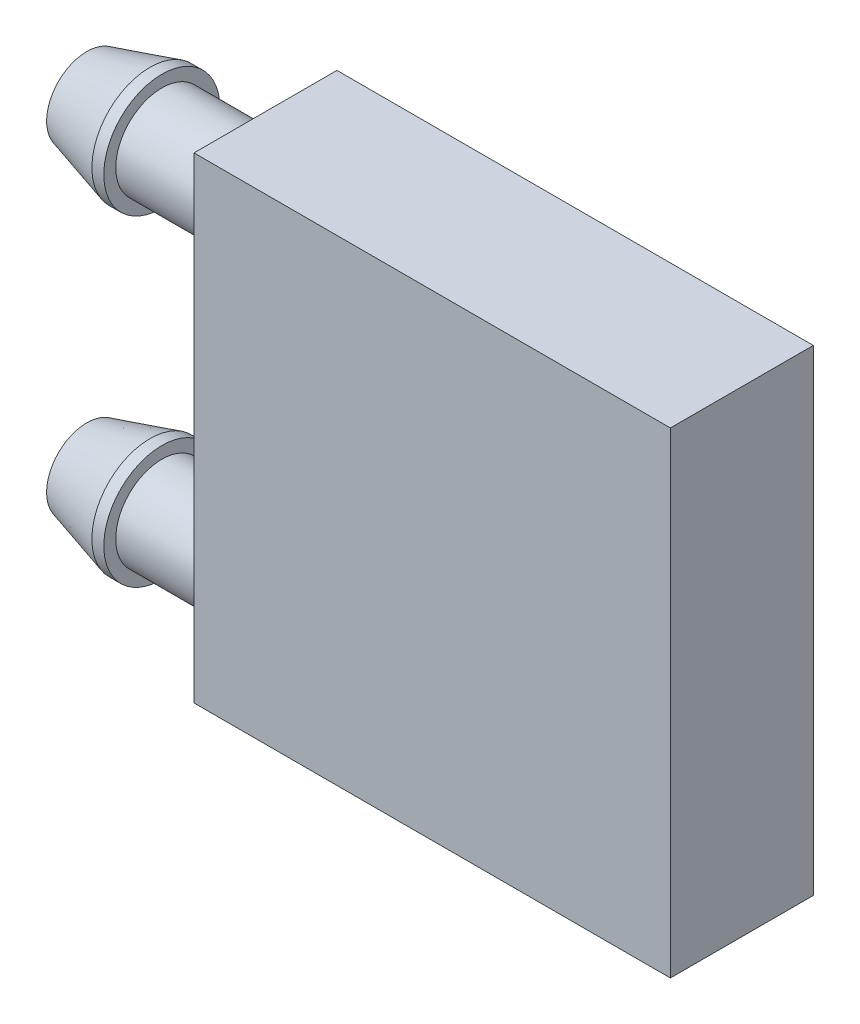
from build123d import *

# Parameters (mm, degrees)
BOSS_EXTRUDE_BASE_DEPTH      = 6
BOSS_EXTRUDE_BASE_DEPTH_BACK = 6
BASE_W                       = 40.00000001
BASE_H                       = 40


with BuildPart() as part:
    # Base → Boss-Extrude Base (new, two sides: drawn at the far end of the back side and taken through both)
    with BuildSketch(Plane.XY.offset(-BOSS_EXTRUDE_BASE_DEPTH_BACK)):
        with Locations((-10, 0)):
            Rectangle(BASE_W, BASE_H)
    extrude(amount=BOSS_EXTRUDE_BASE_DEPTH + BOSS_EXTRUDE_BASE_DEPTH_BACK)

    # Port Profile → Revolve Port (revolve)
    with BuildSketch(Plane.XY):
        Polygon((-30.000000005, 16.375000092), (-45.000000005, 16.375000092), (-45.000000005, 16.875000092), (-39.700000005, 18.375000092), (-38.700000005, 18.375000092), (-38.700000005, 17.375000092), (-31.000000037, 17.375000092), (-31.000000037, 18.375000092), (-30.000000005, 18.375000092), align=None)
    revolve_port = revolve(axis=Axis((-30, 13.5, 0), (-1, 0, 0)))

    # Mirror Port: Revolve Port across plane
    add(revolve_port.mirror(Plane.ZX))


solid = part.part
